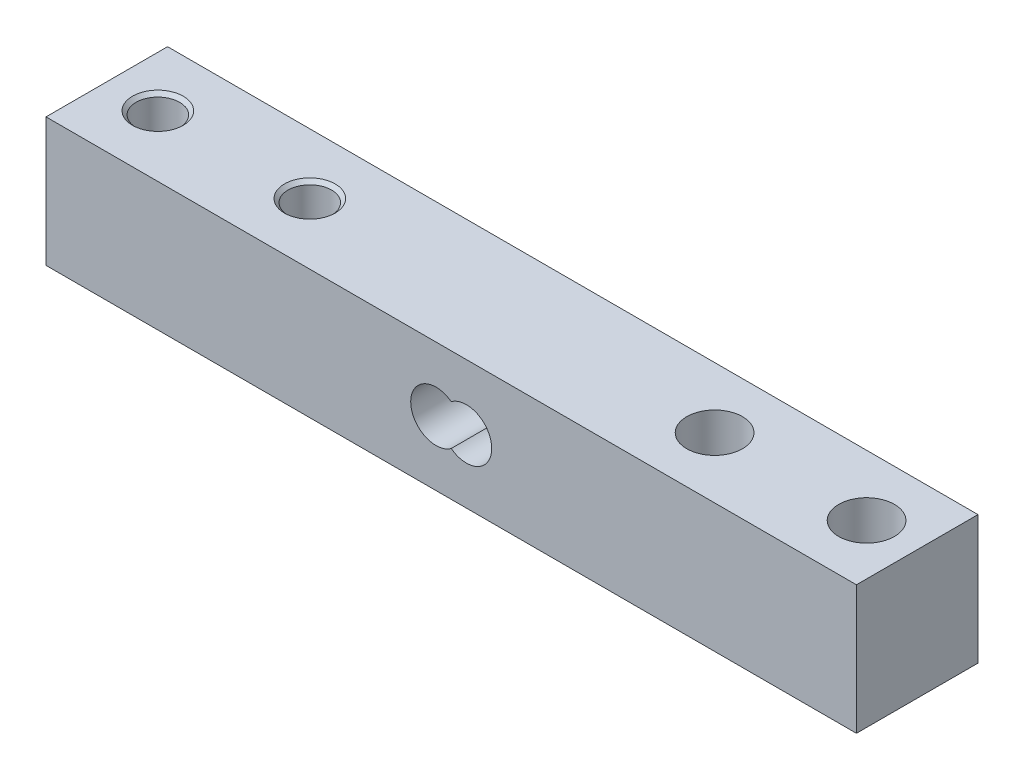
from build123d import *

# Parameters (mm, degrees)
SKETCH1_W                                       = 80
SKETCH1_H                                       = 12.7
BASE_SHAPE_DEPTH                                = 12
CSK_FOR_M4_FLAT_HEAD_MACHINE_SCREW1_D           = 4.3
CSK_FOR_M4_FLAT_HEAD_MACHINE_SCREW1_CSINK_D     = 5
CSK_FOR_M4_FLAT_HEAD_MACHINE_SCREW1_CSINK_ANGLE = 90
CSK_FOR_M5_COUNTERSUNK_FLAT_HEAD1_D             = 5.5
CSK_FOR_M5_COUNTERSUNK_FLAT_HEAD1_CSINK_D       = 6
CSK_FOR_M5_COUNTERSUNK_FLAT_HEAD1_CSINK_ANGLE   = 90


with BuildPart() as part:
    # Sketch1 → Base Shape (new body)
    with BuildSketch(Plane.XY):
        with Locations((-40, 6.35)):
            Rectangle(SKETCH1_W, SKETCH1_H)
        with BuildLine():
            ThreePointArc((-40, 4.35), (-44, 6.35), (-40, 8.35))
            ThreePointArc((-40, 8.35), (-37.381966011, 8.586067977), (-36, 6.35))
            ThreePointArc((-36, 6.35), (-37.381966011, 4.113932023), (-40, 4.35))
        make_face(mode=Mode.SUBTRACT)
    extrude(amount=BASE_SHAPE_DEPTH)

    # CSK for M4 Flat Head Machine Screw1 (through all)
    with Locations(Plane(origin=(0, 12.7, 0), x_dir=(1, 0, 0), z_dir=(0, 1, 0))):
        with Locations((-75, -5.958952658), (-60, -5.958952658)):
            CounterSinkHole(CSK_FOR_M4_FLAT_HEAD_MACHINE_SCREW1_D / 2, CSK_FOR_M4_FLAT_HEAD_MACHINE_SCREW1_CSINK_D / 2, counter_sink_angle=CSK_FOR_M4_FLAT_HEAD_MACHINE_SCREW1_CSINK_ANGLE)

    # CSK for M5 Countersunk Flat Head1 (through all)
    with Locations(Plane(origin=(0, 0, 0), x_dir=(-1, 0, 0), z_dir=(0, -1, 0))):
        with Locations((20, -6), (5, -6)):
            CounterSinkHole(CSK_FOR_M5_COUNTERSUNK_FLAT_HEAD1_D / 2, CSK_FOR_M5_COUNTERSUNK_FLAT_HEAD1_CSINK_D / 2, counter_sink_angle=CSK_FOR_M5_COUNTERSUNK_FLAT_HEAD1_CSINK_ANGLE)


solid = part.part
